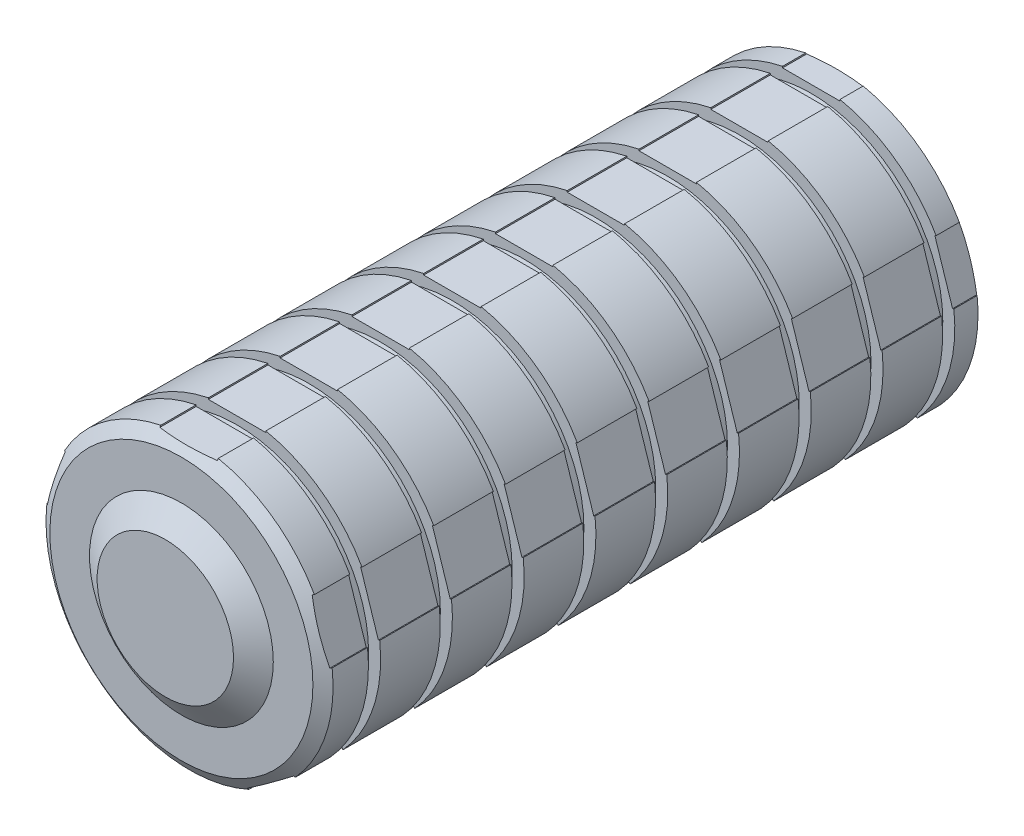
from build123d import *

# Parameters (mm, degrees)
SKETCH_1_R          = 2000
EXTRUDE_1_DEPTH     = 10000
SKETCH_2_W          = 1241.297250029
SKETCH_2_H          = 169.816997768
SKETCH_2_W_2        = 1241.29725003
SKETCH_4_W          = 800
SKETCH_4_H          = 560
CUT_EXTRUDE_1_DEPTH = 10000


with BuildPart() as part:
    # 草图1 → 凸台-拉伸1 (new body)
    with BuildSketch(Plane.XY):
        Circle(SKETCH_1_R)
    extrude(amount=EXTRUDE_1_DEPTH)

    # 草图2 → 切除-旋转2 (revolve, cut)
    with BuildSketch(Plane(origin=(0, 0, 0), x_dir=(1, 0, 0), z_dir=(0, 1, 0))):
        Polygon((488.223868582, 101.585641274), (488.223868582, -266.351187222), (842.009280599, -266.351187222), (1280.703191499, -563.530933316), (1832.608434244, -563.530933316), (2350.728243291, -914.51532009), (3073.905684273, -914.51532009), (3073.905684273, 313.856888484), (488.223868582, 313.856888484), align=None)
        with Locations((2453.257059259, -1084.908498884)):
            Rectangle(SKETCH_2_W, SKETCH_2_H)
        with Locations((2453.257059259, -2084.908498884)):
            Rectangle(SKETCH_2_W, SKETCH_2_H)
        with Locations((2453.257059259, -3084.908498884)):
            Rectangle(SKETCH_2_W, SKETCH_2_H)
        with Locations((2453.257059259, -4084.908498884)):
            Rectangle(SKETCH_2_W, SKETCH_2_H)
        with Locations((2453.257059259, -5084.908498884)):
            Rectangle(SKETCH_2_W, SKETCH_2_H)
        with Locations((2453.257059259, -6084.908498884)):
            Rectangle(SKETCH_2_W, SKETCH_2_H)
        with Locations((2453.257059259, -7084.908498884)):
            Rectangle(SKETCH_2_W, SKETCH_2_H)
        with Locations((2453.257059259, -8084.908498884)):
            Rectangle(SKETCH_2_W, SKETCH_2_H)
        with Locations((2453.257059259, -9084.908498884)):
            Rectangle(SKETCH_2_W_2, SKETCH_2_H)
        Polygon((1832.608434244, -9776.103062219), (2350.728243291, -9425.118675446), (3073.905684273, -9425.118675446), (3073.905684273, -10653.49088402), (488.223868582, -10653.49088402), (488.223868582, -10441.21963681), (488.223868582, -10073.282808313), (842.009280599, -10073.282808313), (1280.703191499, -9776.103062219), align=None)
    revolve(axis=Axis((0, 0, 10000), (0, 0, -1)), mode=Mode.SUBTRACT)

    # 草图4 → 切除-拉伸1 (cut)
    with BuildSketch(Plane.XY):
        with Locations((0, 2220)):
            Rectangle(SKETCH_4_W, SKETCH_4_H)
        Polygon((2254.034492988, 1152.965092455), (1721.442843863, 979.915575606), (1968.656439363, 219.070362569), (2501.248088488, 392.119879419), align=None)
        Polygon((1793.069928481, -1787.42838502), (1463.910187197, -1334.37886817), (816.696591698, -1804.607070004), (1145.856332981, -2257.656586854), align=None)
        Polygon((-1145.856332981, -2257.656586854), (-816.696591697, -1804.607070004), (-1463.910187197, -1334.37886817), (-1793.069928481, -1787.42838502), align=None)
        Polygon((-2501.248088488, 392.119879419), (-1968.656439363, 219.070362569), (-1721.442843863, 979.915575605), (-2254.034492988, 1152.965092455), align=None)
    extrude(amount=CUT_EXTRUDE_1_DEPTH, mode=Mode.SUBTRACT)


solid = part.part
